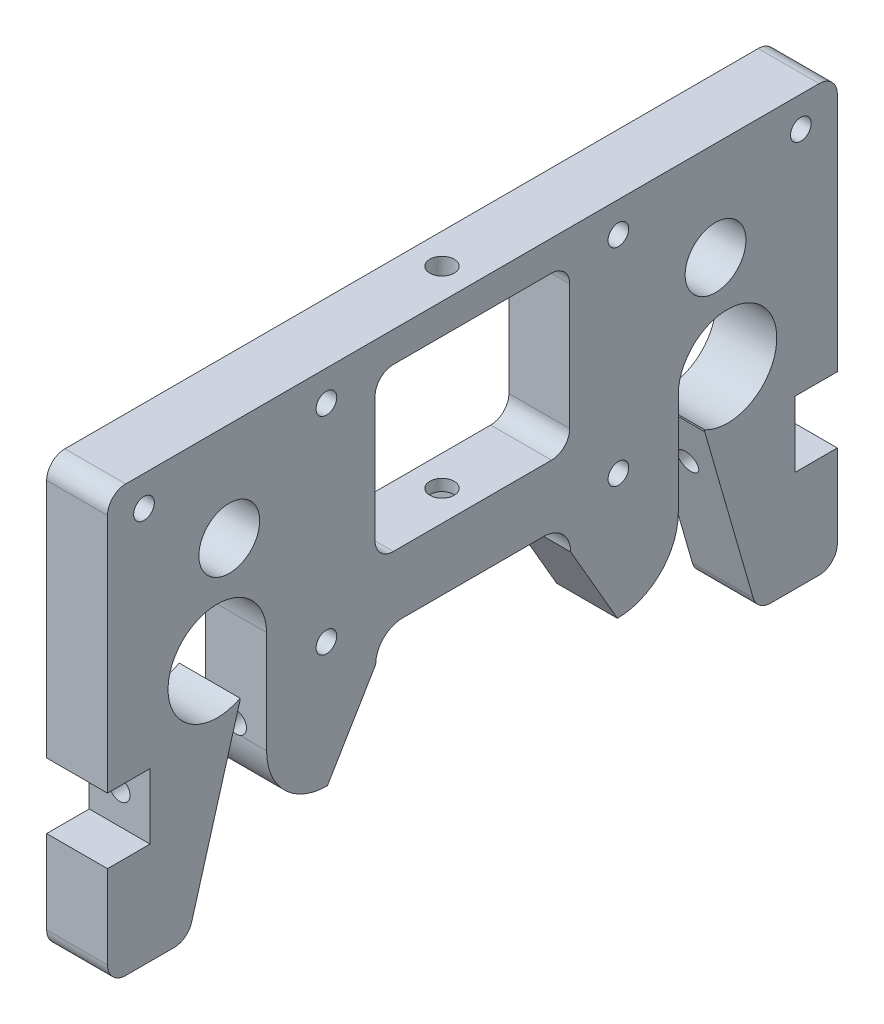
from build123d import *

# Parameters (mm, degrees)
SKETCH_1_R          = 1.7
EXTRUDE_1_DEPTH     = 10
CUT_EXTRUDE_1_DEPTH = 37
SKETCH_3_W          = 3
SKETCH_3_H          = 5.795399196
SKETCH_3_W_2        = 5.804634465
SKETCH_3_H_2        = 3.015219691
SKETCH_3_H_3        = 5.79316294
CUT_EXTRUDE_2_DEPTH = 8
SKETCH_5_R          = 1.7
CUT_EXTRUDE_3_DEPTH = 35
CUT_EXTRUDE_START   = -35
SKETCH_6_R          = 1.7
CUT_EXTRUDE_4_DEPTH = 35
CUT_EXTRUDE_5_DEPTH = 10
SKETCH_9_R          = 5
CUT_EXTRUDE_6_DEPTH = 10
SKETCH_10_W         = 10
SKETCH_10_H         = 10.755893821
CUT_EXTRUDE_7_DEPTH = 7
SKETCH_13_W         = 10.237652643
SKETCH_13_H         = 10.849423333
CUT_EXTRUDE_8_DEPTH = 7


with BuildPart() as part:
    # Эскиз1 → Бобышка-Вытянуть1 (new body)
    with BuildSketch(Plane(origin=(0, 0, 0), x_dir=(0, 0, -1), z_dir=(1, 0, 0))):
        with BuildLine():
            Line((3, 0), (10.95312335, 0))
            ThreePointArc((10.95312335, 0), (12.757186433, 0.603052693), (13.835952782, 2.169762405))
            Line((13.835952782, 2.169762405), (21.800132861, 29.823741049))
            Line((21.800132861, 29.823741049), (21.800132861, 30.090305699))
            ThreePointArc((21.800132861, 30.090305699), (11.129115214, 41.472470419), (26.155254044, 37.272536706))
            Line((26.155254044, 37.272536706), (26.155045577, 20.433139704))
            ThreePointArc((26.155045577, 20.433139704), (29.083933995, 13.361991864), (36.155045576, 10.433015907))
            Line((36.155045576, 10.433015907), (83.844954424, 10.433015907))
            ThreePointArc((83.844954424, 10.433015907), (90.916066005, 13.361991864), (93.844954423, 20.433139704))
            Line((93.844954423, 20.433139704), (93.844745956, 37.272536706))
            ThreePointArc((93.844745956, 37.272536706), (108.870884786, 41.472470419), (98.199867139, 30.090305699))
            Line((98.199867139, 30.090305699), (98.199867139, 29.823741049))
            Line((98.199867139, 29.823741049), (106.164047218, 2.169762405))
            ThreePointArc((106.164047218, 2.169762405), (107.242813567, 0.603052693), (109.04687665, 0))
            Line((109.04687665, 0), (117, 0))
            ThreePointArc((117, 0), (119.121320344, 0.878679656), (120, 3))
            Line((120, 3), (120, 67))
            ThreePointArc((120, 67), (119.121320344, 69.121320344), (117, 70))
            Line((117, 70), (3, 70))
            ThreePointArc((3, 70), (0.878679656, 69.121320344), (0, 67))
            Line((0, 67), (0, 3))
            ThreePointArc((0, 3), (0.878679656, 0.878679656), (3, 0))
        make_face()
        with Locations((36, 65)):
            Circle(SKETCH_1_R, mode=Mode.SUBTRACT)
        with Locations((6, 65)):
            Circle(SKETCH_1_R, mode=Mode.SUBTRACT)
        with Locations((36, 31)):
            Circle(SKETCH_1_R, mode=Mode.SUBTRACT)
        with Locations((84, 31)):
            Circle(SKETCH_1_R, mode=Mode.SUBTRACT)
        with Locations((84, 65)):
            Circle(SKETCH_1_R, mode=Mode.SUBTRACT)
        with Locations((114, 65)):
            Circle(SKETCH_1_R, mode=Mode.SUBTRACT)
        with BuildLine():
            Line((47, 65), (73, 65))
            ThreePointArc((73, 65), (75.121320344, 64.121320344), (76, 62))
            Line((76, 62), (76, 41.380344056))
            ThreePointArc((76, 41.380344056), (75.121320344, 39.259023712), (73, 38.380344056))
            Line((73, 38.380344056), (47, 38.380344056))
            ThreePointArc((47, 38.380344056), (44.878679656, 39.259023712), (44, 41.380344056))
            Line((44, 41.380344056), (44, 62))
            ThreePointArc((44, 62), (44.878679656, 64.121320344), (47, 65))
        make_face(mode=Mode.SUBTRACT)
        with BuildLine():
            Line((48.512942473, 28.14808317), (71.745561711, 28.14808317))
            ThreePointArc((71.745561711, 28.14808317), (76.161679417, 23.731965464), (71.745561711, 19.315847758))
            Line((71.745561711, 19.315847758), (48.512942473, 19.315847758))
            ThreePointArc((48.512942473, 19.315847758), (44.096824767, 23.731965464), (48.512942473, 28.14808317))
        make_face(mode=Mode.SUBTRACT)
    extrude(amount=EXTRUDE_1_DEPTH)

    # Эскиз2 → Вырез-Вытянуть1 (cut)
    with BuildSketch(Plane(origin=(0, 70, 0), x_dir=(1, 0, 0), z_dir=(0, 1, 0))):
        with BuildLine():
            ThreePointArc((7, 60), (6.414213562, 61.414213562), (5, 62))
            Line((5, 62), (5, 60))
            Line((5, 60), (7, 60))
        make_face()
        with BuildLine():
            Line((5, 60), (5, 62))
            ThreePointArc((5, 62), (3.585786438, 58.585786438), (7, 60))
            Line((7, 60), (5, 60))
        make_face()
    extrude(amount=-CUT_EXTRUDE_1_DEPTH, mode=Mode.SUBTRACT)

    # Эскиз3 → Вырез-Вытянуть2 (cut)
    with BuildSketch(Plane.ZY):
        with Locations((-89.477143784, 21.994873796)):
            Rectangle(SKETCH_3_W, SKETCH_3_H)
        with Locations((-60.018321185, 34.987499707)):
            Rectangle(SKETCH_3_W_2, SKETCH_3_H_2)
        with Locations((-30.522856216, 21.995572621)):
            Rectangle(SKETCH_3_W, SKETCH_3_H_3)
    extrude(amount=-CUT_EXTRUDE_2_DEPTH, mode=Mode.SUBTRACT)

    # Эскиз5 → Вырез-Вытянуть3 (cut)
    with BuildSketch(Plane(origin=(0, 0, -120), x_dir=(-1, 0, 0), z_dir=(0, 0, -1))):
        with Locations(Location((-5, 22, 0), (0, 0, 292.826691269))):
            Circle(SKETCH_5_R)
    extrude(amount=-CUT_EXTRUDE_3_DEPTH, mode=Mode.SUBTRACT)

    # Эскиз6 → Вырез-Вытянуть4 (cut)
    with BuildSketch(Plane.XY.offset(CUT_EXTRUDE_START)):
        with Locations(Location((5, 22, 0), (0, 0, 247.173308731))):
            Circle(SKETCH_6_R)
    extrude(amount=CUT_EXTRUDE_4_DEPTH, mode=Mode.SUBTRACT)

    # Эскиз7 → Вырез-Вытянуть5 (cut)
    with BuildSketch(Plane.ZY):
        Polygon((-76.161679417, 23.731965464), (-83.844954424, 10.433015907), (-36.155045576, 10.433015907), (-44.096824767, 23.731965464), align=None)
    extrude(amount=-CUT_EXTRUDE_5_DEPTH, mode=Mode.SUBTRACT)

    # Эскиз9 → Вырез-Вытянуть6 (cut)
    with BuildSketch(Plane.ZY):
        with Locations((-99.973969782, 53.749400687)):
            Circle(SKETCH_9_R)
        with Locations((-20.026030218, 53.749400687)):
            Circle(SKETCH_9_R)
    extrude(amount=-CUT_EXTRUDE_6_DEPTH, mode=Mode.SUBTRACT)

    # Эскиз10 → Вырез-Вытянуть7 (cut)
    with BuildSketch(Plane.XY):
        with Locations((5, 22.092927416)):
            Rectangle(SKETCH_10_W, SKETCH_10_H)
    extrude(amount=-CUT_EXTRUDE_7_DEPTH, mode=Mode.SUBTRACT)

    # Эскиз13 → Вырез-Вытянуть8 (cut)
    with BuildSketch(Plane(origin=(0, 0, -120), x_dir=(-1, 0, 0), z_dir=(0, 0, -1))):
        with Locations((-5.118826322, 22.046162659)):
            Rectangle(SKETCH_13_W, SKETCH_13_H)
    extrude(amount=-CUT_EXTRUDE_8_DEPTH, mode=Mode.SUBTRACT)


solid = part.part
